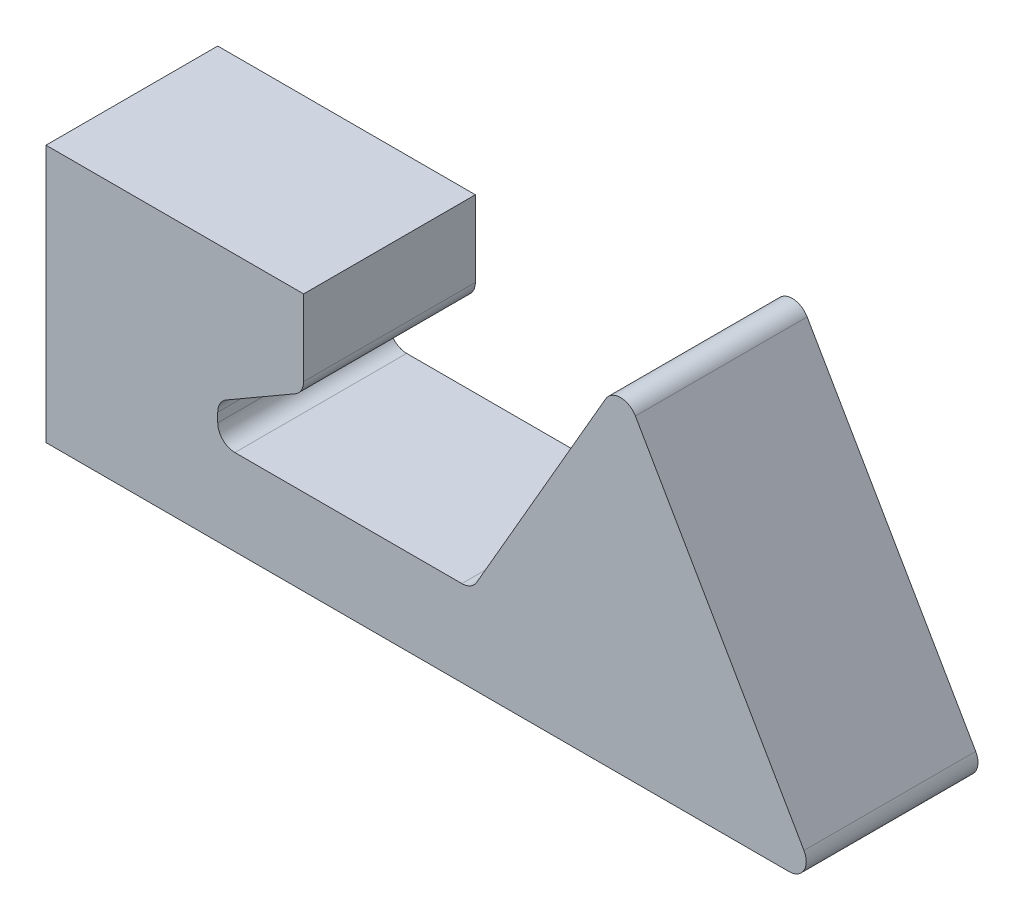
from build123d import *

# Parameters (mm, degrees)
BOSS_EXTRUDE1_DEPTH = 20
FILLET1_R           = 2


with BuildPart() as part:
    # Sketch1 → Boss-Extrude1 (new body)
    with BuildSketch(Plane.XY):
        Polygon((0, 0), (90, 0), (66.905989232, 40), (49.585481157, 10), (20, 10), (20, 14.226497308), (30, 20), (30, 30), (0, 30), align=None)
    extrude(amount=BOSS_EXTRUDE1_DEPTH)

    # Fillet1
    fillet1_edges = [part.edges().sort_by_distance(p)[0] for p in [
        (30, 20, 10),
        (20, 14.226497308, 10),
        (20, 10, 10),
        (49.585481157, 10, 10),
        (66.905989232, 40, 10),
        (90, 0, 10),
    ]]
    fillet(fillet1_edges, radius=FILLET1_R)


solid = part.part
